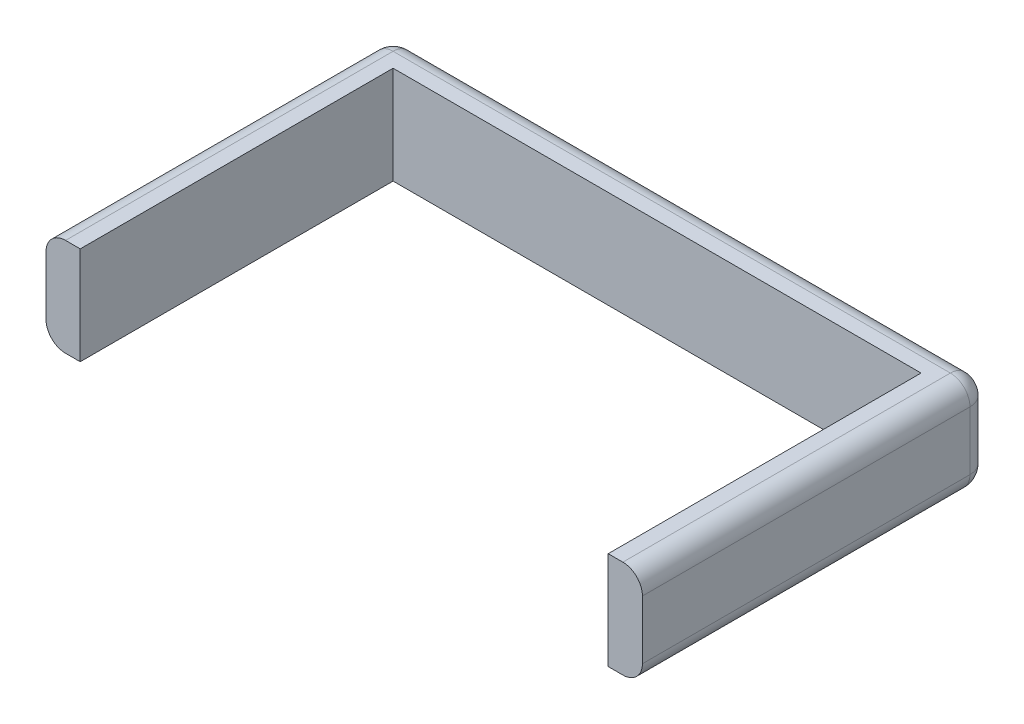
from build123d import *

# Parameters (mm, degrees)
BOSS_EXTRUDE1_DEPTH = 127
FILLET1_R           = 25.4


with BuildPart() as part:
    # Sketch2 → Boss-Extrude1 (new body)
    with BuildSketch(Plane(origin=(0, 0, 0), x_dir=(1, 0, 0), z_dir=(0, 1, 0))):
        Polygon((-387.35, 450.85), (387.35, 450.85), (387.35, 0), (342.9, 0), (342.9, 406.4), (-342.9, 406.4), (-342.9, 0), (-387.35, 0), align=None)
    extrude(amount=BOSS_EXTRUDE1_DEPTH)

    # Fillet1
    fillet1_edges = [part.edges().sort_by_distance(p)[0] for p in [
        (0, 0, -450.85),
        (387.35, 0, -225.425),
        (387.35, 127, -225.425),
        (-387.35, 63.5, -450.85),
        (387.35, 63.5, -450.85),
        (0, 127, -450.85),
        (-387.35, 127, -225.425),
        (-387.35, 0, -225.425),
    ]]
    fillet(fillet1_edges, radius=FILLET1_R)


solid = part.part
